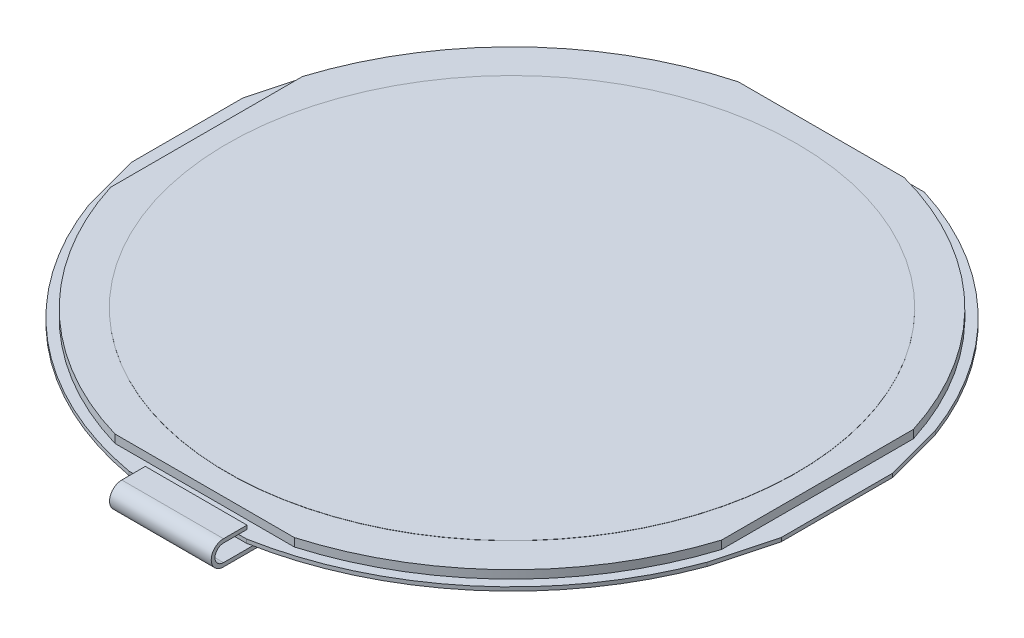
from build123d import *

# Parameters (mm, degrees)
BOSS_EXTRUDE1_DEPTH = 0.2
BOSS_EXTRUDE5_DEPTH = 0.435
SKETCH5_R           = 15.12
BOSS_EXTRUDE6_DEPTH = 0.01
LPATTERN1_COUNT     = 2
LPATTERN1_PITCH     = 0.4
BOSS_EXTRUDE7_DEPTH = 2.7


with BuildPart() as part:
    # Sketch1 → Boss-Extrude1 (new body)
    with BuildSketch(Plane(origin=(0, 0, 0), x_dir=(1, 0, 0), z_dir=(0, 1, 0))):
        with BuildLine():
            Line((17.249992572, 2.9475), (17.249992572, -2.9475))
            Line((17.249992572, -2.9475), (16.412681783, -6.072386409))
            ThreePointArc((16.412681783, -6.072386409), (11.243979481, -13.409807061), (3.117762689, -17.22003356))
            Line((3.117762689, -17.22003356), (-3.117762689, -17.22003356))
            ThreePointArc((-3.117762689, -17.22003356), (-11.243979481, -13.409807061), (-16.412681783, -6.072386409))
            Line((-16.412681783, -6.072386409), (-17.249992572, -2.9475))
            Line((-17.249992572, -2.9475), (-17.249992572, 2.9475))
            Line((-17.249992572, 2.9475), (-16.412681783, 6.072386409))
            ThreePointArc((-16.412681783, 6.072386409), (-12.031542367, 12.707949806), (-5.1665, 16.71996644))
            Line((-5.1665, 16.71996644), (5.1665, 16.71996644))
            ThreePointArc((5.1665, 16.71996644), (12.031542367, 12.707949806), (16.412681783, 6.072386409))
            Line((16.412681783, 6.072386409), (17.249992572, 2.9475))
        make_face()
    extrude(amount=BOSS_EXTRUDE1_DEPTH)

    # Sketch2 → Boss-Extrude5 (add)
    with BuildSketch(Plane(origin=(0, 0.2, 0), x_dir=(1, 0, 0), z_dir=(0, 1, 0))):
        with BuildLine():
            Line((-4.402806164, 16.41996644), (4.402806164, 16.41996644))
            ThreePointArc((4.402806164, 16.41996644), (11.764995572, 12.271303076), (16.22, 5.0903438))
            Line((16.22, 5.0903438), (16.22, -5.0903438))
            ThreePointArc((16.22, -5.0903438), (11.898124894, -12.142266016), (4.759884935, -16.32003356))
            Line((4.759884935, -16.32003356), (-4.759884935, -16.32003356))
            ThreePointArc((-4.759884935, -16.32003356), (-11.898124894, -12.142266016), (-16.22, -5.0903438))
            Line((-16.22, -5.0903438), (-16.22, 5.0903438))
            ThreePointArc((-16.22, 5.0903438), (-11.764995572, 12.271303076), (-4.402806164, 16.41996644))
        make_face()
    boss_extrude5 = extrude(amount=BOSS_EXTRUDE5_DEPTH)

    # Sketch5 → Boss-Extrude6 (add)
    with BuildSketch(Plane(origin=(0, 0.635, 0), x_dir=(1, 0, 0), z_dir=(0, 1, 0))):
        with Locations(Location((0, 0, 0), (0, 0, 90))):
            Circle(SKETCH5_R)
    extrude(amount=BOSS_EXTRUDE6_DEPTH)

    # LPattern1: Boss-Extrude5 ×2
    with Locations(*[(0, -i * LPATTERN1_PITCH, 0) for i in range(1, LPATTERN1_COUNT)]):
        add(boss_extrude5)

    # Sketch6 → Boss-Extrude7 (add, symmetric)
    with BuildSketch(Plane.ZY):
        with BuildLine():
            Line((17.22003356, 0.2), (18.02003356, 0.2))
            ThreePointArc((18.02003356, 0.2), (18.47003356, -0.25), (18.02003356, -0.7))
            Line((18.02003356, -0.7), (-0.77996644, -0.7))
            Line((-0.77996644, -0.7), (-0.77996644, -0.9))
            Line((-0.77996644, -0.9), (18.02003356, -0.9))
            ThreePointArc((18.02003356, -0.9), (18.67003356, -0.25), (18.02003356, 0.4))
            Line((18.02003356, 0.4), (16.77003356, 0.4))
            Line((16.77003356, 0.4), (16.77003356, 0.2))
            Line((16.77003356, 0.2), (17.22003356, 0.2))
        make_face()
    extrude(amount=BOSS_EXTRUDE7_DEPTH, both=True)


solid = part.part
